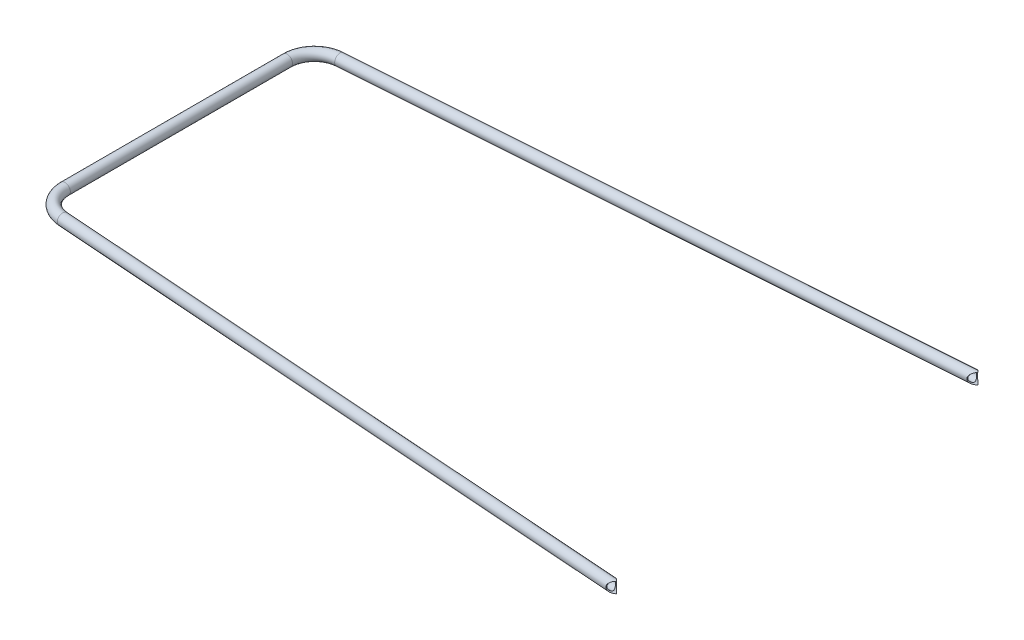
from build123d import *

# Parameters (mm, degrees)
SKETCH1_ON_SEGMENT_1_R               = 7.9375
SKETCH1_ON_SEGMENT_1_R_2             = 6.4375
PIPE_CONFIGURED_21_3_X_2_3_1_DEPTH   = 875.073706959
SKETCH1_ON_SEGMENT_2_R               = 7.9375
SKETCH1_ON_SEGMENT_2_R_2             = 6.4375
PIPE_CONFIGURED_21_3_X_2_3_1_2_ANGLE = 85.91438322
SKETCH1_ON_SEGMENT_3_R               = 7.9375
SKETCH1_ON_SEGMENT_3_R_2             = 6.4375
PIPE_CONFIGURED_21_3_X_2_3_1_3_DEPTH = 325.510463728
SKETCH1_ON_SEGMENT_4_R               = 7.9375
SKETCH1_ON_SEGMENT_4_R_2             = 6.4375
PIPE_CONFIGURED_21_3_X_2_3_1_4_ANGLE = 85.91438322
SKETCH1_R                            = 7.9375
SKETCH1_R_2                          = 6.4375
PIPE_CONFIGURED_21_3_X_2_3_1_5_DEPTH = 875.073706959
CORTE_EXTRUS_O1_DEPTH                = 951.618979706
CORTE_EXTRUS_O1_DEPTH_BACK           = 951.618979706
ESBO_O2_R                            = 7.9375


with BuildPart() as part:
    # Sketch1 on segment 1 (carried to segment 1) → Pipe - configured 21.3 X 2.3(1) (new body)
    with BuildSketch(Plane(origin=(37.150118, 0, -202.653579857), x_dir=(-0.07124705, 0, -0.9974587), z_dir=(0.9974587, 0, -0.07124705))):
        Circle(SKETCH1_ON_SEGMENT_1_R)
        Circle(SKETCH1_ON_SEGMENT_1_R_2, mode=Mode.SUBTRACT)
    extrude(amount=PIPE_CONFIGURED_21_3_X_2_3_1_DEPTH)


with BuildPart() as body_2:
    # Sketch1 on segment 2 (carried to the start of arc 2) → Pipe - configured 21.3 X 2.3_1 2 (revolve)
    with BuildSketch(Plane(origin=(0, 0, -162.755231864), x_dir=(-1, 0, 0), z_dir=(0, 0, -1))):
        Circle(SKETCH1_ON_SEGMENT_2_R)
        Circle(SKETCH1_ON_SEGMENT_2_R_2, mode=Mode.SUBTRACT)
    revolve(axis=Axis((40, 0, -162.755231864), (0, -1, 0)), revolution_arc=PIPE_CONFIGURED_21_3_X_2_3_1_2_ANGLE)


with BuildPart() as body_3:
    # Sketch1 on segment 3 (carried to segment 3) → Pipe - configured 21.3 X 2.3_1 3 (new body)
    with BuildSketch(Plane.XY.offset(-162.755231864)):
        Circle(SKETCH1_ON_SEGMENT_3_R)
        Circle(SKETCH1_ON_SEGMENT_3_R_2, mode=Mode.SUBTRACT)
    extrude(amount=PIPE_CONFIGURED_21_3_X_2_3_1_3_DEPTH)


with BuildPart() as body_4:
    # Sketch1 on segment 4 (carried to the start of arc 4) → Pipe - configured 21.3 X 2.3_1 4 (revolve)
    with BuildSketch(Plane.XY.offset(162.755231864)):
        Circle(SKETCH1_ON_SEGMENT_4_R)
        Circle(SKETCH1_ON_SEGMENT_4_R_2, mode=Mode.SUBTRACT)
    revolve(axis=Axis((40, 0, 162.755231864), (0, 1, 0)), revolution_arc=PIPE_CONFIGURED_21_3_X_2_3_1_4_ANGLE)


with BuildPart() as body_5:
    # Sketch1 → Pipe - configured 21.3 X 2.3_1 5 (new body)
    with BuildSketch(Plane(origin=(37.150118, 0, 202.653579857), x_dir=(0.07124704998790964, 0, -0.997458699830735), z_dir=(0.997458699830735, 0, 0.07124704998790964))):
        Circle(SKETCH1_R)
        Circle(SKETCH1_R_2, mode=Mode.SUBTRACT)
    extrude(amount=PIPE_CONFIGURED_21_3_X_2_3_1_5_DEPTH)


with BuildPart() as corte_extrus_o1_tool:
    # Esboço2 → Corte-extrusão1 (new, two sides: drawn at the far end of the back side and taken through both)
    with BuildSketch(Plane.XY.offset(-CORTE_EXTRUS_O1_DEPTH_BACK)):
        with Locations((910, 0)):
            Circle(ESBO_O2_R)
    extrude(amount=CORTE_EXTRUS_O1_DEPTH + CORTE_EXTRUS_O1_DEPTH_BACK)


with BuildPart() as part_1:
    add(part.part)

    # Corte-extrusão1: cut by corte_extrus_o1_tool
    add(corte_extrus_o1_tool.part, mode=Mode.SUBTRACT)


with BuildPart() as body_5_1:
    add(body_5.part)

    # Corte-extrusão1: cut by corte_extrus_o1_tool
    add(corte_extrus_o1_tool.part, mode=Mode.SUBTRACT)


solid = Compound([body_2.part, body_3.part, body_4.part, part_1.part, body_5_1.part])
